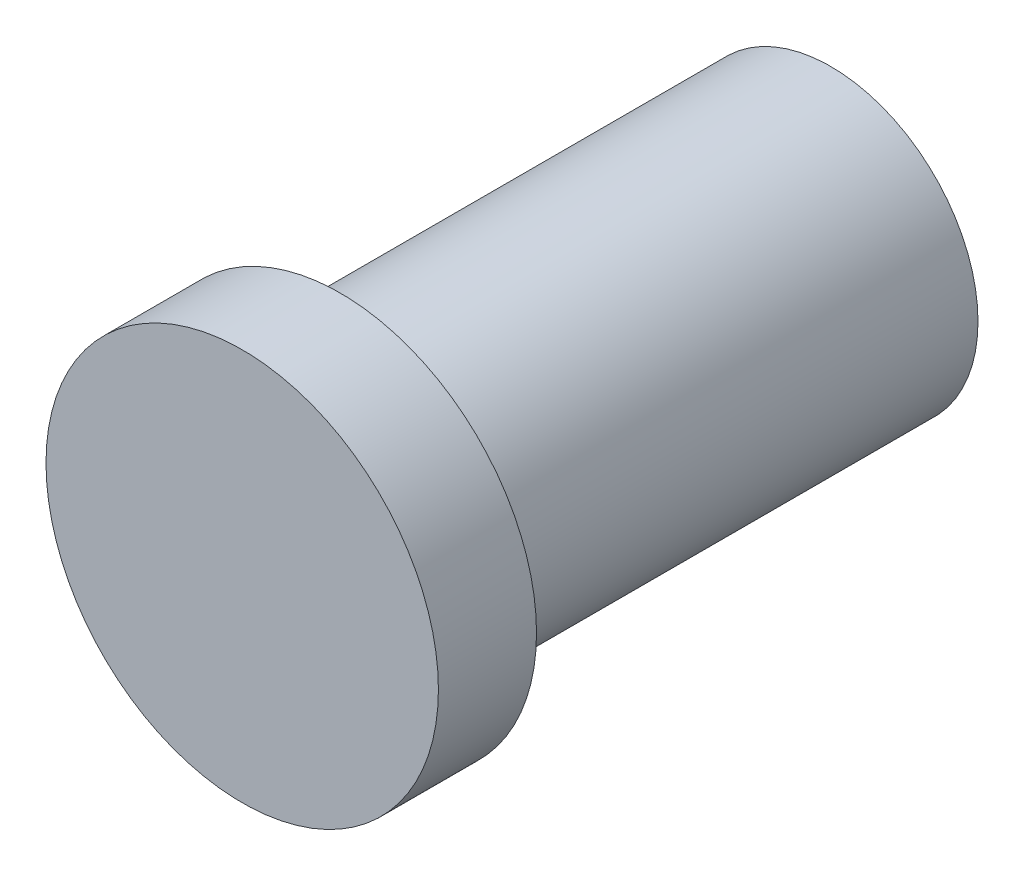
from build123d import *

# Parameters (mm, degrees)
SKETCH1_R           = 3.81
BOSS_EXTRUDE1_DEPTH = 12.7
SKETCH2_R           = 5.08
BOSS_EXTRUDE2_DEPTH = 2.54


with BuildPart() as part:
    # Sketch1 → Boss-Extrude1 (new body)
    with BuildSketch(Plane.XY):
        Circle(SKETCH1_R)
    extrude(amount=BOSS_EXTRUDE1_DEPTH)

    # Sketch2 → Boss-Extrude2 (add)
    with BuildSketch(Plane.XY.offset(12.7)):
        Circle(SKETCH2_R)
    extrude(amount=BOSS_EXTRUDE2_DEPTH)


solid = part.part
